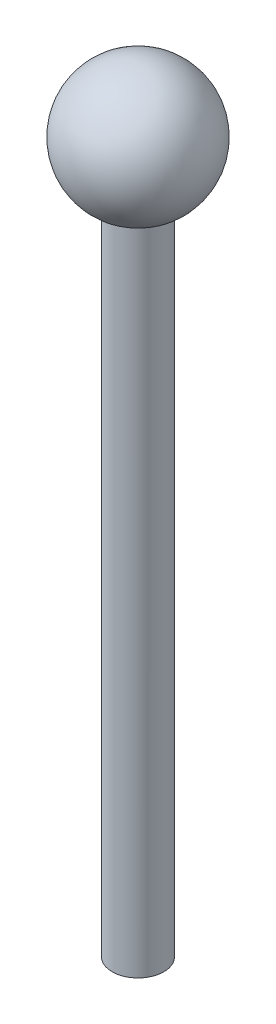
from build123d import *


with BuildPart() as part:
    # Sketch1 → Revolve1 (revolve)
    with BuildSketch(Plane.XY, mode=Mode.PRIVATE) as revolve1_sk:
        with BuildLine():
            Line((0, 0), (-2, 0))
            Line((-2, 0), (-2, 50.417424305))
            ThreePointArc((-2, 50.417424305), (-4.894531565, 56.021548218), (0, 60))
            Line((0, 60), (0, 0))
        make_face()
    revolve(revolve1_sk.sketch.rotate(Axis((0, 0, 0), (0, 1, 0)), 180), axis=Axis((0, 0, 0), (0, 1, 0)))


solid = part.part
